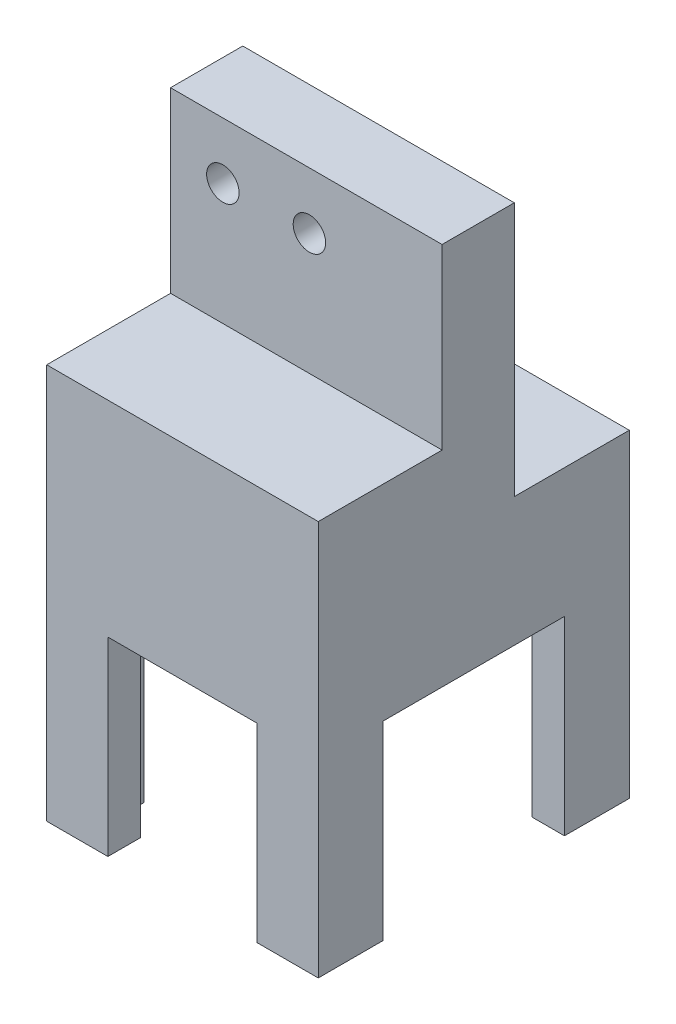
from build123d import *

# Parameters (mm, degrees)
SKETCH4_W           = 25.1
SKETCH4_H           = 28.75
BOSS_EXTRUDE2_DEPTH = 53
SKETCH5_W           = 19.1
SKETCH5_H           = 22.75
CUT_EXTRUDE1_DEPTH  = 21.67
FILLET1_R           = 4.1
SKETCH6_W           = 2.88
SKETCH6_H           = 5.1
CUT_EXTRUDE2_DEPTH  = 4.67
SKETCH7_W           = 16.769550268
SKETCH7_H           = 35.14
CUT_EXTRUDE3_DEPTH  = 40
SKETCH8_W           = 13.798322684
SKETCH8_H           = 35.14
CUT_EXTRUDE4_DEPTH  = 40
SKETCH9_W           = 8.5
SKETCH9_H           = 16.46
CUT_EXTRUDE5_DEPTH  = 40
SKETCH10_W          = 10.629287706
SKETCH10_H          = 23.523496481
CUT_EXTRUDE6_DEPTH  = 40
SKETCH11_W          = 25.1
SKETCH11_H          = 2.9448388
CUT_EXTRUDE7_DEPTH  = 16.46
SKETCH14_R          = 1.5
CUT_EXTRUDE10_DEPTH = 23.1
SKETCH13_R          = 1.5
CUT_EXTRUDE11_DEPTH = 23.1


with BuildPart() as part:
    # Sketch4 → Boss-Extrude2 (new body)
    with BuildSketch(Plane(origin=(0, 0, 0), x_dir=(1, 0, 0), z_dir=(0, 1, 0))):
        Rectangle(SKETCH4_W, SKETCH4_H)
    extrude(amount=BOSS_EXTRUDE2_DEPTH)

    # Sketch5 → Cut-Extrude1 (cut)
    with BuildSketch(Plane(origin=(0, 0, 0), x_dir=(-1, 0, 0), z_dir=(0, -1, 0))):
        Rectangle(SKETCH5_W, SKETCH5_H)
    extrude(amount=-CUT_EXTRUDE1_DEPTH, mode=Mode.SUBTRACT)

    # Fillet1
    fillet1_edges = [part.edges().sort_by_distance(p)[0] for p in [
        (0, 21.67, -11.375),
        (0, 21.67, 11.375),
    ]]
    fillet(fillet1_edges, radius=FILLET1_R)

    # Sketch6 → Cut-Extrude2 (cut)
    with BuildSketch(Plane(origin=(0, 21.67, 0), x_dir=(-1, 0, 0), z_dir=(0, -1, 0))):
        Rectangle(SKETCH6_W, SKETCH6_H)
    extrude(amount=-CUT_EXTRUDE2_DEPTH, mode=Mode.SUBTRACT)

    # Sketch7 → Cut-Extrude3 (cut)
    with BuildSketch(Plane(origin=(12.55, 0, 0), x_dir=(0, 0, -1), z_dir=(1, 0, 0))):
        Rectangle(SKETCH7_W, SKETCH7_H)
    extrude(amount=-CUT_EXTRUDE3_DEPTH, mode=Mode.SUBTRACT)

    # Sketch8 → Cut-Extrude4 (cut)
    with BuildSketch(Plane(origin=(0, 0, -14.375), x_dir=(-1, 0, 0), z_dir=(0, 0, -1))):
        Rectangle(SKETCH8_W, SKETCH8_H)
    extrude(amount=-CUT_EXTRUDE4_DEPTH, mode=Mode.SUBTRACT)

    # Sketch9 → Cut-Extrude5 (cut)
    with BuildSketch(Plane.ZY.offset(12.55)):
        with Locations((10.125, 44.77)):
            Rectangle(SKETCH9_W, SKETCH9_H)
    extrude(amount=-CUT_EXTRUDE5_DEPTH, mode=Mode.SUBTRACT)

    # Sketch10 → Cut-Extrude6 (cut)
    with BuildSketch(Plane.ZY.offset(12.55)):
        with Locations((-9.060356147, 41.23825176)):
            Rectangle(SKETCH10_W, SKETCH10_H)
    extrude(amount=-CUT_EXTRUDE6_DEPTH, mode=Mode.SUBTRACT)

    # Sketch11 → Cut-Extrude7 (cut)
    with BuildSketch(Plane(origin=(0, 53, 0), x_dir=(1, 0, 0), z_dir=(0, 1, 0))):
        with Locations((0, -4.4025806)):
            Rectangle(SKETCH11_W, SKETCH11_H)
    extrude(amount=-CUT_EXTRUDE7_DEPTH, mode=Mode.SUBTRACT)

    # Sketch14 → Cut-Extrude10 (cut)
    with BuildSketch(Plane(origin=(0, 0, -3.745712294), x_dir=(-1, 0, 0), z_dir=(0, 0, -1))):
        with Locations((-0.286761368, 47.74761558)):
            Circle(SKETCH14_R)
    extrude(amount=-CUT_EXTRUDE10_DEPTH, mode=Mode.SUBTRACT)

    # Sketch13 → Cut-Extrude11 (cut)
    with BuildSketch(Plane(origin=(0, 0, -3.745712294), x_dir=(-1, 0, 0), z_dir=(0, 0, -1))):
        with Locations((7.713238632, 47.74761558)):
            Circle(SKETCH13_R)
    extrude(amount=-CUT_EXTRUDE11_DEPTH, mode=Mode.SUBTRACT)


solid = part.part
